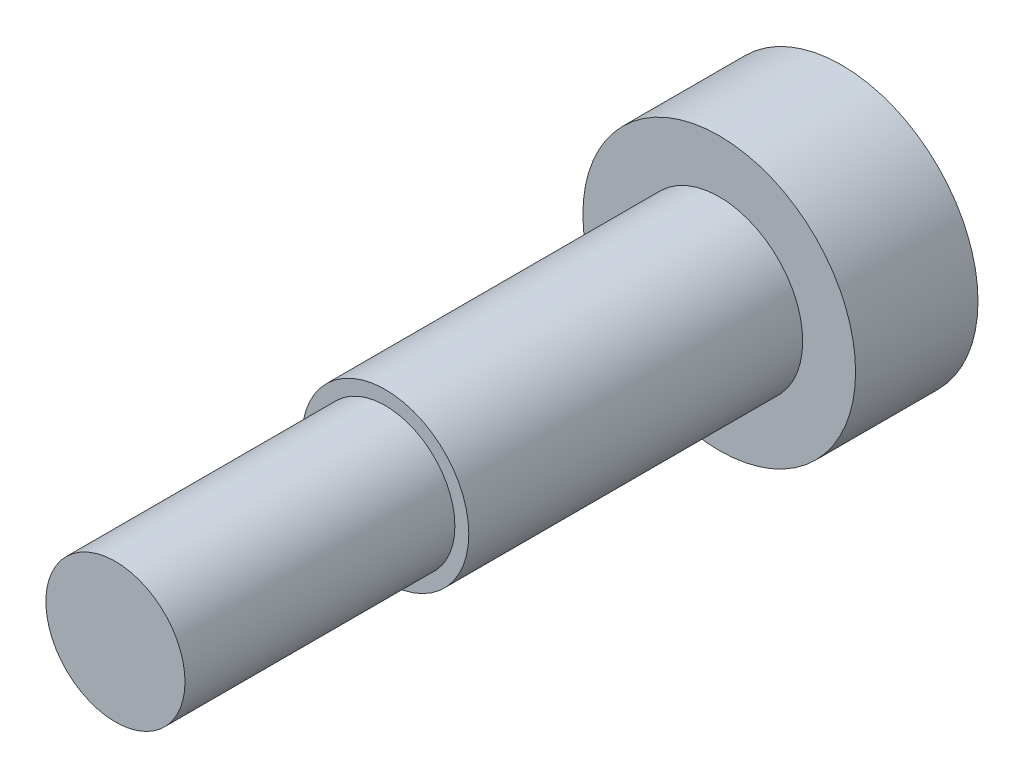
from build123d import *

# Parameters (mm, degrees)
SKETCH_1_R          = 4.9
EXTRUDE_1_DEPTH     = 4.4
SKETCH_2_R          = 3
EXTRUDE_2_DEPTH     = 12
SKETCH_3_R          = 2.5
EXTRUDE_3_DEPTH     = 9.7
CUT_EXTRUDE_1_DEPTH = 2


with BuildPart() as part:
    # 草图1 → 凸台-拉伸1 (new body)
    with BuildSketch(Plane.XY):
        Circle(SKETCH_1_R)
    extrude(amount=EXTRUDE_1_DEPTH)

    # 草图2 → 凸台-拉伸2 (add)
    with BuildSketch(Plane.XY.offset(4.4)):
        Circle(SKETCH_2_R)
    extrude(amount=EXTRUDE_2_DEPTH)

    # 草图3 → 凸台-拉伸3 (add)
    with BuildSketch(Plane.XY.offset(16.4)):
        Circle(SKETCH_3_R)
    extrude(amount=EXTRUDE_3_DEPTH)

    # 草图4 → 切除-拉伸1 (cut)
    with BuildSketch(Plane(origin=(0, 0, 0), x_dir=(-1, 0, 0), z_dir=(0, 0, -1))):
        Polygon((0, 1.732050808), (-1.5, 0.866025404), (-1.5, -0.866025404), (0, -1.732050808), (1.5, -0.866025404), (1.5, 0.866025404), align=None)
    extrude(amount=-CUT_EXTRUDE_1_DEPTH, mode=Mode.SUBTRACT)


solid = part.part
